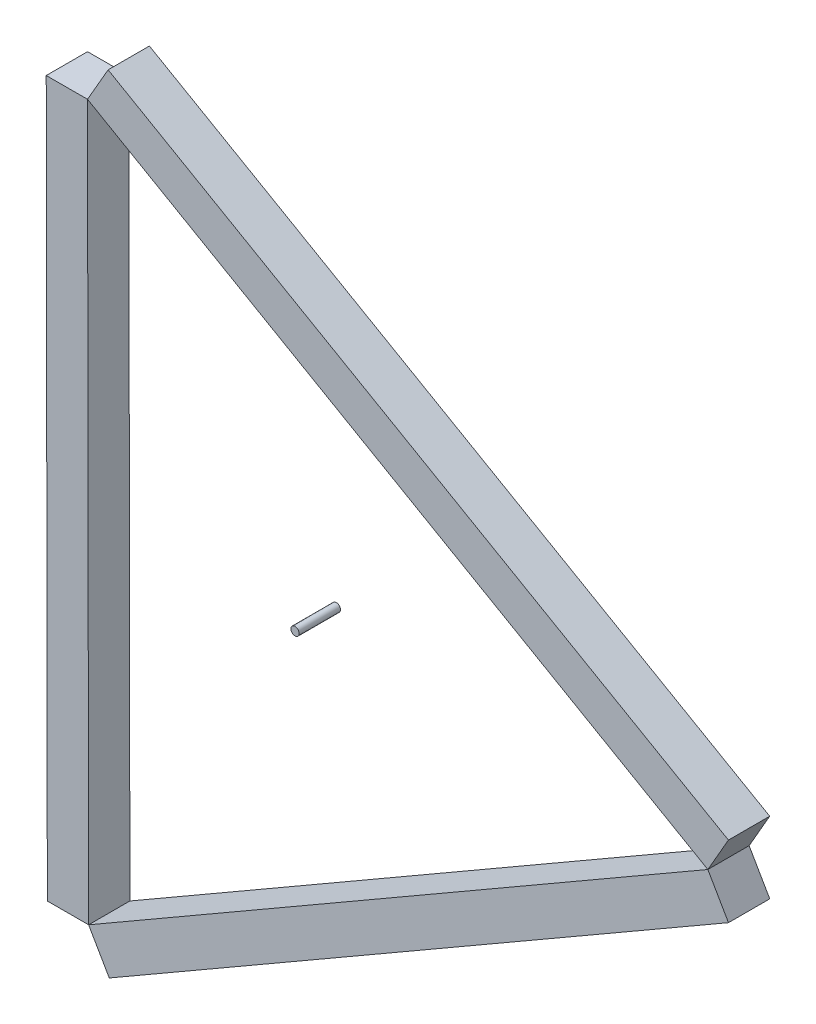
from build123d import *

# Parameters (mm, degrees)
SKETCH1_R           = 10
BOSS_EXTRUDE1_DEPTH = 50


with BuildPart() as part:
    # Sketch1 → Boss-Extrude1 (new, symmetric)
    with BuildSketch(Plane.XY):
        Polygon((-585.007153272, 557.133458435), (-602.226330597, 586.957948427), (-600.41372537, -596.075731726), (-579.69958337, -560.197785347), (-500.398429433, -605.982327919), (-502.253720562, 604.911175087), align=None)
        Polygon((-502.65143742, 864.489174287), (-602.385941237, 691.131080307), (-602.226330597, 586.957948427), (-585.007153272, 557.133458435), (-502.253720562, 604.911175087), align=None)
        Polygon((-602.651320044, 864.335957761), (-602.385941237, 691.131080307), (-502.65143742, 864.489174287), align=None)
        Polygon((-195.295721569, 782.133458435), (-277.253016301, 734.81539226), (774.99530494, 129.447267809), (774.99530494, 228.064326912), (804.111954534, 228.064326912), (-213.363096355, 813.427069525), align=None)
        Polygon((-302.119031537, 864.489174287), (-502.65143742, 864.489174287), (-277.253016301, 734.81539226), (-195.295721569, 782.133458435), (-213.363096355, 813.427069525), align=None)
        Polygon((-452.784185512, 951.168221277), (-502.65143742, 864.489174287), (-302.119031537, 864.489174287), align=None)
        Polygon((1000, 0), (774.99530494, -129.906521262), (774.99530494, -221.935673088), (815.596138199, -221.935673088), (900, -173.205080757), align=None)
        Polygon((1050, -86.602540378), (1000, 0), (900, -173.205080757), align=None)
        Polygon((774.99530494, 228.064326912), (774.99530494, 129.447267809), (1000, 0), (900.791585986, 172.443646903), (804.111954534, 228.064326912), align=None)
        Polygon((900.791585986, 172.443646903), (1000, 0), (1049.867251908, 86.67904699), align=None)
        Polygon((774.99530494, -129.906521262), (-274.995304939, -736.118882522), (-189.988151667, -785.197785347), (-204.980998395, -811.16615763), (815.596138199, -221.935673088), (774.99530494, -221.935673088), align=None)
        Polygon((-274.995304939, -736.118882522), (-500, -866.025403784), (-300, -866.025403784), (-204.980998395, -811.16615763), (-189.988151667, -785.197785347), align=None)
        Polygon((-300, -866.025403784), (-500, -866.025403784), (-450, -952.627944163), align=None)
        Polygon((-600.41372537, -596.075731726), (-600.266202942, -692.359246007), (-500, -866.025403784), (-500.398429433, -605.982327919), (-579.69958337, -560.197785347), align=None)
        Polygon((-500, -866.025403784), (-600.266202942, -692.359246007), (-599.999882623, -866.17862031), align=None)
        Circle(SKETCH1_R)
    extrude(amount=BOSS_EXTRUDE1_DEPTH, both=True)


solid = part.part
